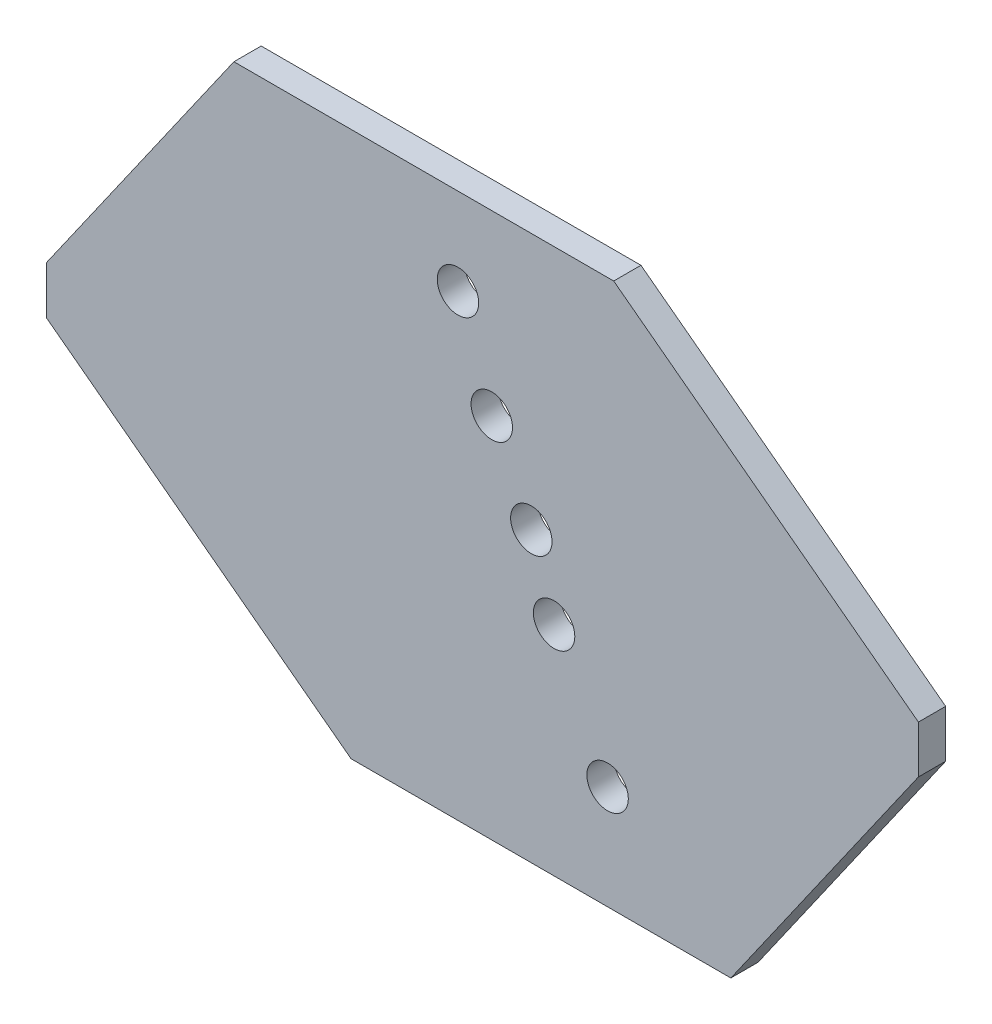
from build123d import *

# Parameters (mm, degrees)
SKETCH1_W           = 101.6
SKETCH1_H           = 63.5
BOSS_EXTRUDE1_DEPTH = 3.175
CUT_EXTRUDE1_DEPTH  = 120.85362166
CUT_EXTRUDE2_DEPTH  = 120.85362166
SKETCH5_R           = 2.413
CUT_EXTRUDE3_DEPTH  = 120.85362166


with BuildPart() as part:
    # Sketch1 → Boss-Extrude1 (new body)
    with BuildSketch(Plane.XY):
        with Locations((50.8, 31.75)):
            Rectangle(SKETCH1_W, SKETCH1_H)
    extrude(amount=BOSS_EXTRUDE1_DEPTH)

    # Sketch2 → Cut-Extrude1 (cut, through all)
    with BuildSketch(Plane.XY.offset(3.175)):
        Polygon((101.6, 31.209692887), (79.746737775, 0), (101.6, 0), align=None)
        Polygon((101.6, 36.749322221), (66.100651578, 63.5), (101.6, 63.5), align=None)
    extrude(amount=-CUT_EXTRUDE1_DEPTH, mode=Mode.SUBTRACT)

    # Sketch3 → Cut-Extrude2 (cut, through all)
    with BuildSketch(Plane.XY.offset(3.175)):
        Polygon((21.853262225, 63.5), (0, 32.290307113), (0, 63.5), align=None)
        Polygon((0, 0), (0, 26.750677779), (35.499348422, 0), align=None)
    extrude(amount=-CUT_EXTRUDE2_DEPTH, mode=Mode.SUBTRACT)

    # Sketch5 → Cut-Extrude3 (cut, through all)
    with BuildSketch(Plane.XY.offset(3.175)):
        with Locations((47.958119633, 53.403997063)):
            Circle(SKETCH5_R)
        with Locations((51.894556786, 42.802795542)):
            Circle(SKETCH5_R)
        with Locations((59.154907323, 25.360400118)):
            Circle(SKETCH5_R)
        with Locations((65.389464521, 12.10291712)):
            Circle(SKETCH5_R)
        with Locations((56.503056774, 33.600657948)):
            Circle(SKETCH5_R)
    extrude(amount=-CUT_EXTRUDE3_DEPTH, mode=Mode.SUBTRACT)


solid = part.part
